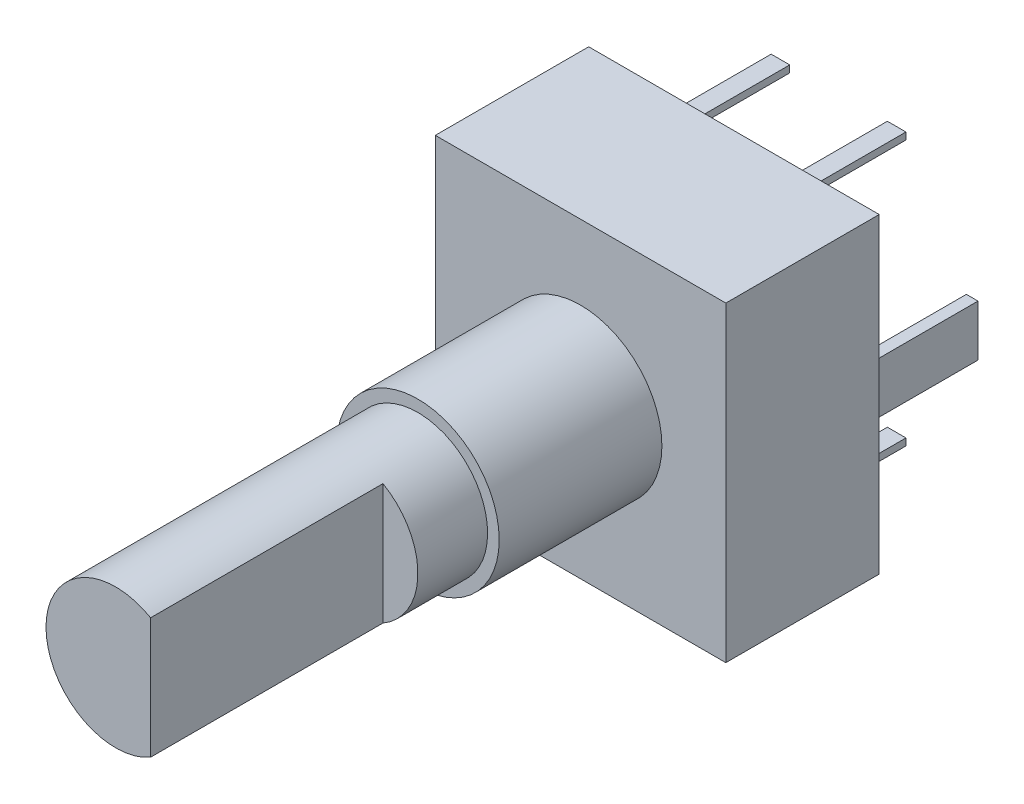
from build123d import *

# Parameters (mm, degrees)
SKETCH1_W     = 12.5
SKETCH1_H     = 13.4
BODY_DEPTH    = 6.6
SKETCH2_R     = 3.5
BUSHING_DEPTH = 7
SKETCH3_R     = 3
SHAFT_DEPTH   = 13
SKETCH4_W     = 0.8
SKETCH4_H     = 0.3
PINS_DEPTH    = 4.5
SKETCH5_W     = 0.5
SKETCH5_H     = 2.2
TABS_DEPTH    = 4.5
SKETCH6_W     = 4
SKETCH6_H     = 8
D_FLAT_DEPTH  = 10


with BuildPart() as part:
    # Sketch1 → Body (new body)
    with BuildSketch(Plane.XY):
        Rectangle(SKETCH1_W, SKETCH1_H)
    extrude(amount=BODY_DEPTH)

    # Sketch2 → Bushing (add)
    with BuildSketch(Plane.XY.offset(6.6)):
        Circle(SKETCH2_R)
    extrude(amount=BUSHING_DEPTH)

    # Sketch3 → Shaft (add)
    with BuildSketch(Plane.XY.offset(13.6)):
        Circle(SKETCH3_R)
    extrude(amount=SHAFT_DEPTH)

    # Sketch4 → Pins (add)
    with BuildSketch(Plane.XY):
        with Locations((-2.5, -5.7)):
            Rectangle(SKETCH4_W, SKETCH4_H)
        with Locations((0, -5.7)):
            Rectangle(SKETCH4_W, SKETCH4_H)
        with Locations((2.5, -5.7)):
            Rectangle(SKETCH4_W, SKETCH4_H)
        with Locations((-2.5, 5.7)):
            Rectangle(SKETCH4_W, SKETCH4_H)
        with Locations((2.5, 5.7)):
            Rectangle(SKETCH4_W, SKETCH4_H)
    extrude(amount=-PINS_DEPTH)

    # Sketch5 → Tabs (add)
    with BuildSketch(Plane.XY):
        with Locations((-5.75, 0)):
            Rectangle(SKETCH5_W, SKETCH5_H)
        with Locations((5.75, 0)):
            Rectangle(SKETCH5_W, SKETCH5_H)
    extrude(amount=-TABS_DEPTH)

    # Sketch6 → D_flat (cut)
    with BuildSketch(Plane.XY.offset(26.6)):
        with Locations((3.5, 0)):
            Rectangle(SKETCH6_W, SKETCH6_H)
    extrude(amount=-D_FLAT_DEPTH, mode=Mode.SUBTRACT)


solid = part.part
